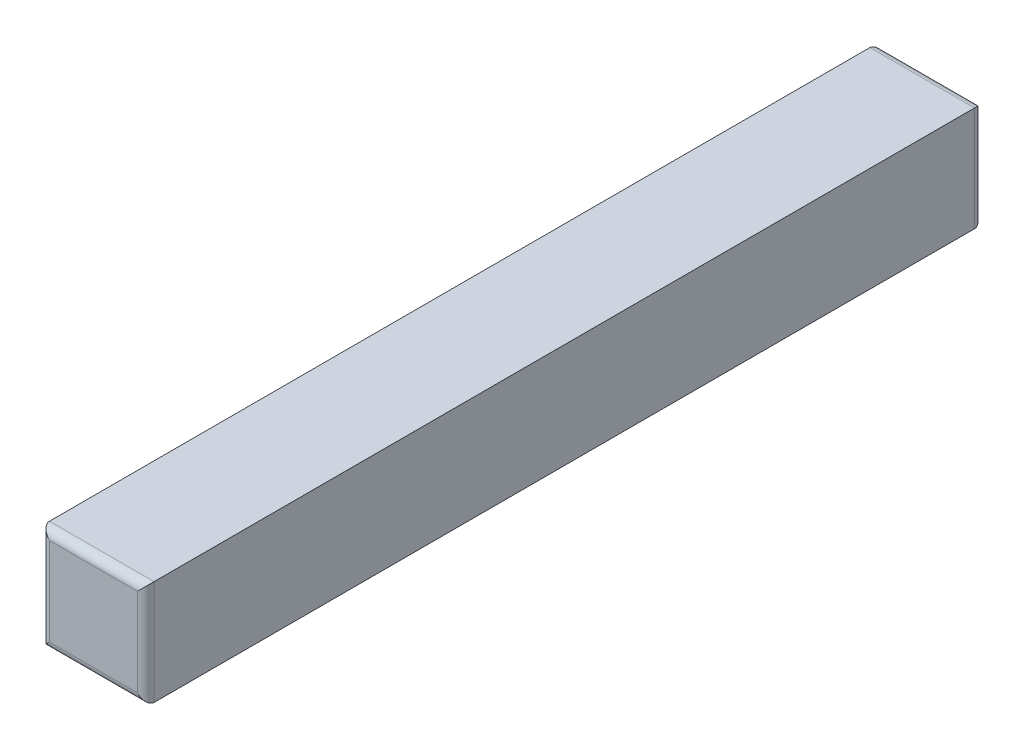
from build123d import *

# Parameters (mm, degrees)
SKETCH1_W           = 3.175
SKETCH1_H           = 3.175
BOSS_EXTRUDE1_DEPTH = 25.4
FILLET1_R           = 0.254
FILLET2_R           = 0.254


with BuildPart() as part:
    # Sketch1 → Boss-Extrude1 (new body)
    with BuildSketch(Plane.XY):
        with Locations((1.5875, 1.5875)):
            Rectangle(SKETCH1_W, SKETCH1_H)
    extrude(amount=-BOSS_EXTRUDE1_DEPTH)

    # Fillet1
    fillet1_edges = [part.edges().sort_by_distance(p)[0] for p in [
        (1.5875, 3.175, 0),
        (3.175, 1.5875, 0),
        (1.5875, 0, 0),
        (0, 1.5875, 0),
    ]]
    fillet(fillet1_edges, radius=FILLET1_R)

    # Fillet2
    fillet2_edges = [part.edges().sort_by_distance(p)[0] for p in [
        (3.175, 1.5875, -25.4),
        (1.5875, 3.175, -25.4),
        (0, 1.5875, -25.4),
        (1.5875, 0, -25.4),
    ]]
    fillet(fillet2_edges, radius=FILLET2_R)


solid = part.part
